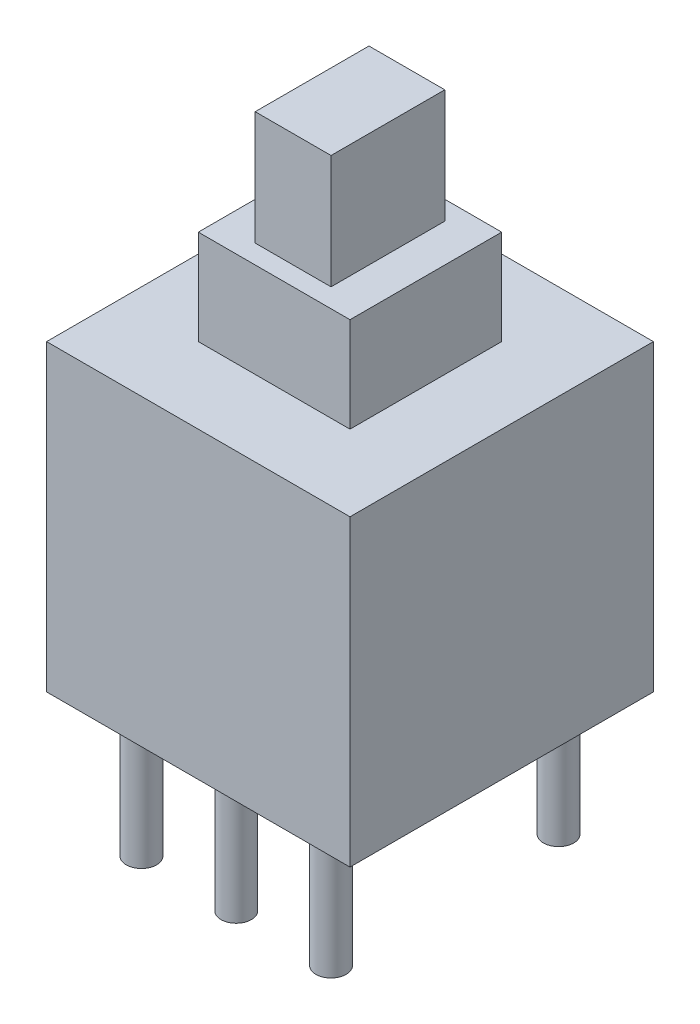
from build123d import *

# Parameters (mm, degrees)
SKETCH1_W               = 8
SKETCH1_H               = 8
BOSS_EXTRUDE1_DEPTH     = 8
SKETCH2_W               = 4
SKETCH2_H               = 4
BOSS_EXTRUDE2_DEPTH     = 5.5
SKETCH3_R               = 0.4
BOSS_EXTRUDE3_DEPTH     = 3.5
SKETCH4_W               = 1
SKETCH4_H               = 4
CUT_EXTRUDE1_DEPTH      = 3
CUT_EXTRUDE2_DEPTH      = 15.637281168
CUT_EXTRUDE2_DEPTH_BACK = 15.637281168
SKETCH5_W               = 0.5
SKETCH5_H               = 3


with BuildPart() as part:
    # Sketch1 → Boss-Extrude1 (new body)
    with BuildSketch(Plane(origin=(0, 0, 0), x_dir=(1, 0, 0), z_dir=(0, 1, 0))):
        Rectangle(SKETCH1_W, SKETCH1_H)
    extrude(amount=BOSS_EXTRUDE1_DEPTH)

    # Sketch2 → Boss-Extrude2 (add)
    with BuildSketch(Plane(origin=(0, 8, 0), x_dir=(1, 0, 0), z_dir=(0, 1, 0))):
        Rectangle(SKETCH2_W, SKETCH2_H)
    extrude(amount=BOSS_EXTRUDE2_DEPTH)

    # Sketch3 → Boss-Extrude3 (add)
    with BuildSketch(Plane.XZ):
        with Locations(Location((0, 3, 0), (0, 0, 90))):
            Circle(SKETCH3_R)
        with Locations(Location((-2.5, 3, 0), (0, 0, 90))):
            Circle(SKETCH3_R)
        with Locations(Location((2.5, 3, 0), (0, 0, 90))):
            Circle(SKETCH3_R)
        with Locations(Location((2.5, -3, 0), (0, 0, 90))):
            Circle(SKETCH3_R)
        with Locations(Location((-2.5, -3, 0), (0, 0, 90))):
            Circle(SKETCH3_R)
        with Locations(Location((0, -3, 0), (0, 0, 90))):
            Circle(SKETCH3_R)
    extrude(amount=BOSS_EXTRUDE3_DEPTH)

    # Sketch4 → Cut-Extrude1 (cut)
    with BuildSketch(Plane(origin=(0, 13.5, 0), x_dir=(1, 0, 0), z_dir=(0, 1, 0))):
        with Locations((-1.5, 0)):
            Rectangle(SKETCH4_W, SKETCH4_H)
        with Locations((1.5, 0)):
            Rectangle(SKETCH4_W, SKETCH4_H)
    extrude(amount=-CUT_EXTRUDE1_DEPTH, mode=Mode.SUBTRACT)

    # Sketch5 → Cut-Extrude2 (cut, two sides: drawn at the far end of the back side and taken through both)
    with BuildSketch(Plane(origin=(0, 0, 0), x_dir=(0, 0, -1), z_dir=(1, 0, 0)).offset(-CUT_EXTRUDE2_DEPTH_BACK)):
        with Locations((-1.75, 12)):
            Rectangle(SKETCH5_W, SKETCH5_H)
        with Locations((1.75, 12)):
            Rectangle(SKETCH5_W, SKETCH5_H)
    extrude(amount=CUT_EXTRUDE2_DEPTH + CUT_EXTRUDE2_DEPTH_BACK, mode=Mode.SUBTRACT)


solid = part.part
